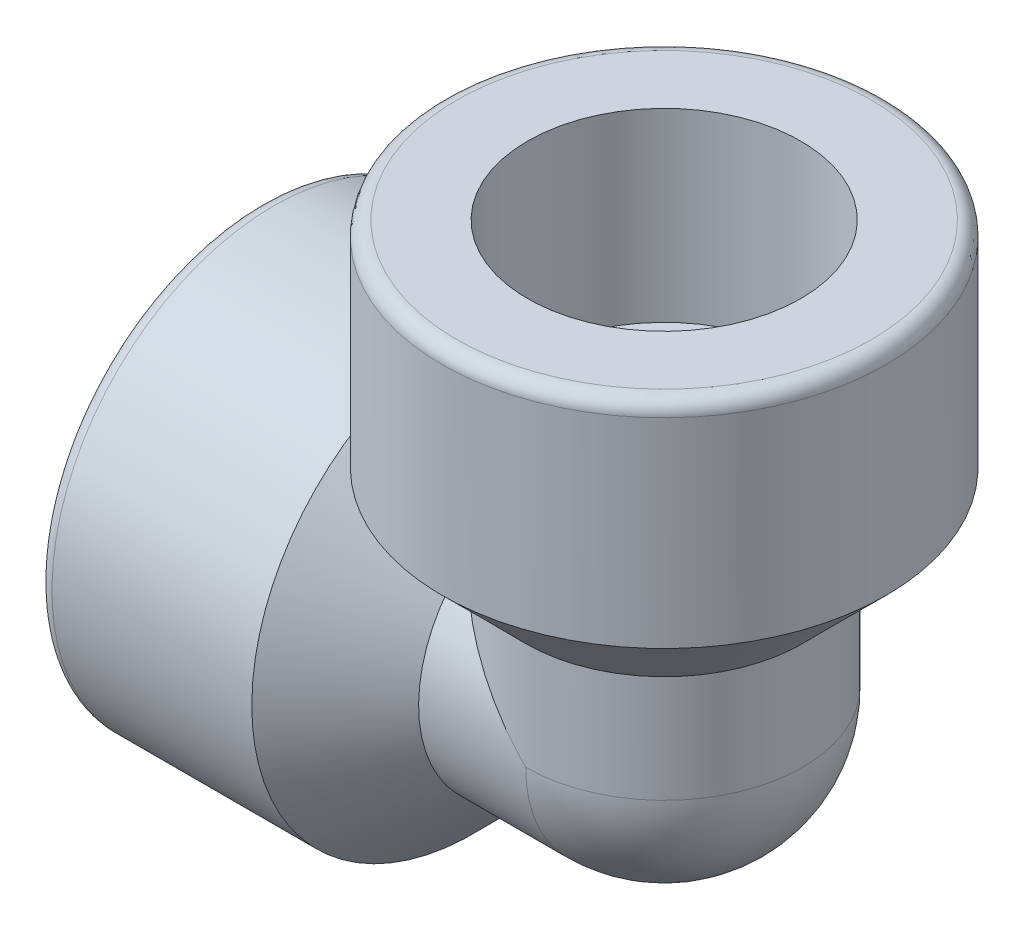
from build123d import *

# Parameters (mm, degrees)
CIRPATTERN2_COUNT  = 2
CIRPATTERN2_ANGLE  = 90
SKETCH4_R          = 4.191
CUT_EXTRUDE1_DEPTH = 32.976017529
SKETCH5_R          = 4.191
CUT_EXTRUDE2_DEPTH = 32.976017529
REVOLVE2_ANGLE     = 90


with BuildPart() as part:
    # Sketch2 → Revolve1 (revolve)
    with BuildSketch(Plane.XY, mode=Mode.PRIVATE) as revolve1_sk:
        with BuildLine():
            Line((-21.082, -7.112), (-11.43, -7.112))
            Line((-11.43, -7.112), (-11.43, -4.191))
            Line((-11.43, -4.191), (0, -4.191))
            Line((0, -4.191), (0, -7.2136))
            Line((0, -7.2136), (-5.5753, -7.2136))
            Line((-5.5753, -7.2136), (-9.9187, -11.557))
            Line((-9.9187, -11.557), (-20.32635, -11.557))
            ThreePointArc((-20.32635, -11.557), (-20.860675239, -11.335675239), (-21.082, -10.80135))
            Line((-21.082, -10.80135), (-21.082, -7.112))
        make_face()
    revolve(revolve1_sk.sketch.rotate(Axis((0, 0, 0), (-1, 0, 0)), 180), axis=Axis((0, 0, 0), (-1, 0, 0)))


with BuildPart() as cirpattern2_1:
    # CirPattern2: pattern copy
    add(part.part.rotate(Axis((0, 0, -11.557), (0, 0, -1)), 1 * CIRPATTERN2_ANGLE / (CIRPATTERN2_COUNT - 1)))

    # Sketch4 → Cut-Extrude1 (cut, through all)
    with BuildSketch(Plane(origin=(0, 0, 0), x_dir=(0, 0, -1), z_dir=(1, 0, 0))):
        with Locations(Location((0, 0, 0), (0, 0, 90))):
            Circle(SKETCH4_R)
    extrude(amount=-CUT_EXTRUDE1_DEPTH, mode=Mode.SUBTRACT)


with BuildPart() as part_1:
    add(part.part)

    # Sketch5 → Cut-Extrude2 (cut, through all)
    with BuildSketch(Plane.XZ):
        Circle(SKETCH5_R)
    extrude(amount=-CUT_EXTRUDE2_DEPTH, mode=Mode.SUBTRACT)

    # Combine1: union CirPattern2_1
    add(cirpattern2_1.part)

    # Sketch6 → Revolve2 (revolve)
    with BuildSketch(Plane(origin=(0, 0, 0), x_dir=(0, 0, -1), z_dir=(1, 0, 0))):
        with BuildLine():
            Line((-7.2136, 0), (-4.191, 0))
            ThreePointArc((-4.191, 0), (0, -4.191), (4.191, 0))
            Line((4.191, 0), (7.2136, 0))
            ThreePointArc((7.2136, 0), (0, -7.2136), (-7.2136, 0))
        make_face()
    revolve(axis=Axis((0, 0, 4.191), (0, 0, 1)), revolution_arc=REVOLVE2_ANGLE)


solid = part_1.part
